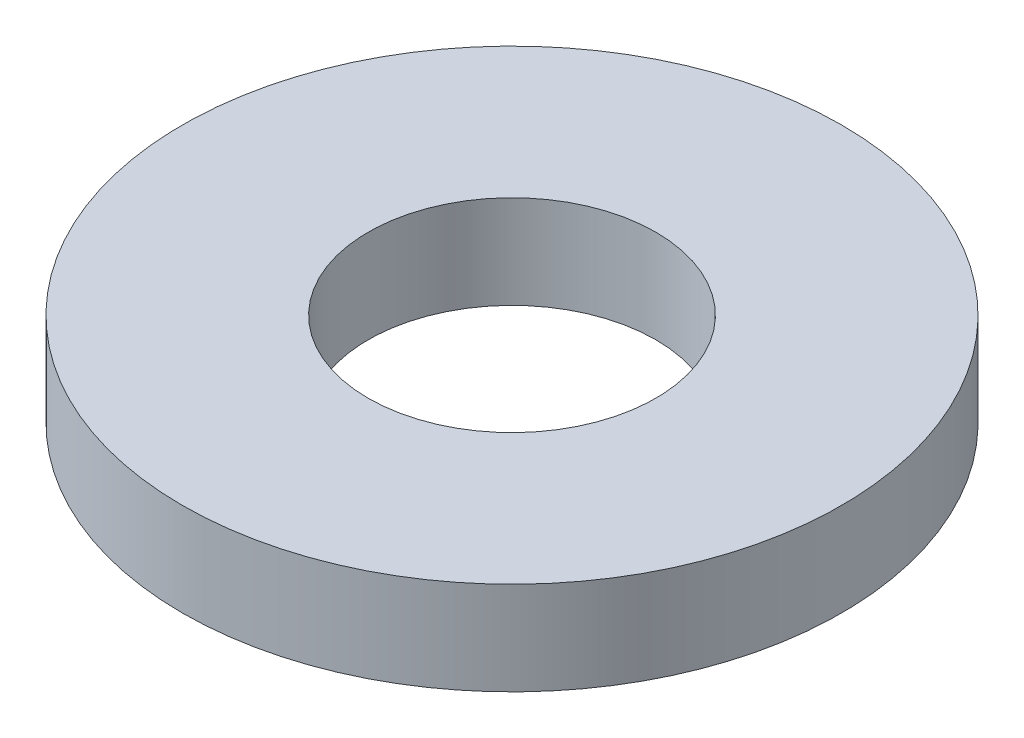
from build123d import *

# Parameters (mm, degrees)
SKETCH1_R           = 4.525
SKETCH1_R_2         = 1.975
BOSS_EXTRUDE1_DEPTH = 1.28


with BuildPart() as part:
    # Sketch1 → Boss-Extrude1 (new body)
    with BuildSketch(Plane(origin=(0, 0, 0), x_dir=(1, 0, 0), z_dir=(0, 1, 0))):
        with Locations(Location((0, 0, 0), (0, 0, 90))):
            Circle(SKETCH1_R)
        with Locations(Location((0, 0, 0), (0, 0, 90))):
            Circle(SKETCH1_R_2, mode=Mode.SUBTRACT)
    extrude(amount=BOSS_EXTRUDE1_DEPTH)


solid = part.part
